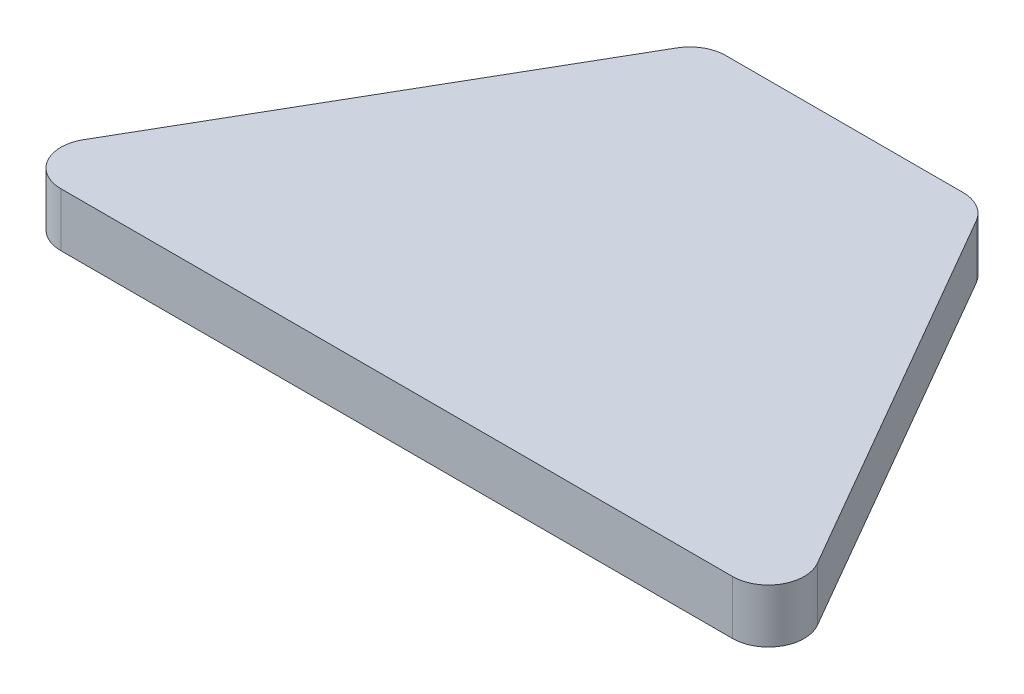
from build123d import *

# Parameters (mm, degrees)
BOSS_EXTRUDE1_DEPTH = 1.5
FILLET5_R           = 2


with BuildPart() as part:
    # Sketch1 → Boss-Extrude1 (new, symmetric)
    with BuildSketch(Plane(origin=(0, 0, 0), x_dir=(1, 0, 0), z_dir=(0, 1, 0))):
        Polygon((-14.297771125, -12.5), (14.297771125, -12.5), (22.216878365, -12.5), (7.783121635, 12.5), (-7.783121635, 12.5), (-22.216878365, -12.5), align=None)
    extrude(amount=BOSS_EXTRUDE1_DEPTH, both=True)

    # Fillet5
    fillet5_edges = [part.edges().sort_by_distance(p)[0] for p in [
        (-22.216878365, 0, 12.5),
        (-7.783121635, 0, -12.5),
        (7.783121635, 0, -12.5),
        (22.216878365, 0, 12.5),
    ]]
    fillet(fillet5_edges, radius=FILLET5_R)


solid = part.part
